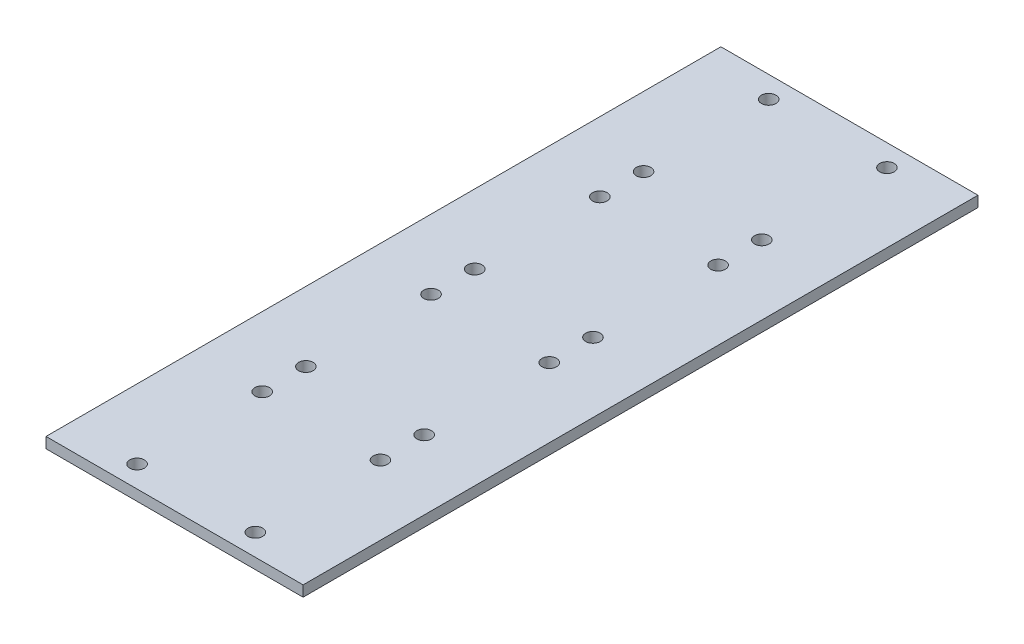
from build123d import *

# Parameters (mm, degrees)
SKETCH1_W           = 76.2
SKETCH1_H           = 200.025
SKETCH1_R           = 2.159
BOSS_EXTRUDE1_DEPTH = 3.175


with BuildPart() as part:
    # Sketch1 → Boss-Extrude1 (new body)
    with BuildSketch(Plane(origin=(0, 0, 0), x_dir=(1, 0, 0), z_dir=(0, 1, 0))):
        with Locations((17.526, 56.515)):
            Rectangle(SKETCH1_W, SKETCH1_H)
        with Locations(Location((0, 0, 0), (0, 0, 270))):
            Circle(SKETCH1_R, mode=Mode.SUBTRACT)
        with Locations(Location((35.052, 0, 0), (0, 0, 270))):
            Circle(SKETCH1_R, mode=Mode.SUBTRACT)
        with Locations(Location((0, -37.084, 0), (0, 0, 270))):
            Circle(SKETCH1_R, mode=Mode.SUBTRACT)
        with Locations(Location((35.052, -37.084, 0), (0, 0, 270))):
            Circle(SKETCH1_R, mode=Mode.SUBTRACT)
        with Locations(Location((0, 50.038, 0), (0, 0, 270))):
            Circle(SKETCH1_R, mode=Mode.SUBTRACT)
        with Locations(Location((35.052, 50.038, 0), (0, 0, 270))):
            Circle(SKETCH1_R, mode=Mode.SUBTRACT)
        with Locations(Location((0, 12.954, 0), (0, 0, 270))):
            Circle(SKETCH1_R, mode=Mode.SUBTRACT)
        with Locations(Location((35.052, 12.954, 0), (0, 0, 270))):
            Circle(SKETCH1_R, mode=Mode.SUBTRACT)
        with Locations(Location((0, 100.076, 0), (0, 0, 270))):
            Circle(SKETCH1_R, mode=Mode.SUBTRACT)
        with Locations(Location((35.052, 100.076, 0), (0, 0, 270))):
            Circle(SKETCH1_R, mode=Mode.SUBTRACT)
        with Locations(Location((0, 62.992, 0), (0, 0, 270))):
            Circle(SKETCH1_R, mode=Mode.SUBTRACT)
        with Locations(Location((35.052, 62.992, 0), (0, 0, 270))):
            Circle(SKETCH1_R, mode=Mode.SUBTRACT)
        with Locations(Location((0, 150.114, 0), (0, 0, 270))):
            Circle(SKETCH1_R, mode=Mode.SUBTRACT)
        with Locations(Location((35.052, 150.114, 0), (0, 0, 270))):
            Circle(SKETCH1_R, mode=Mode.SUBTRACT)
        with Locations(Location((0, 113.03, 0), (0, 0, 270))):
            Circle(SKETCH1_R, mode=Mode.SUBTRACT)
        with Locations(Location((35.052, 113.03, 0), (0, 0, 270))):
            Circle(SKETCH1_R, mode=Mode.SUBTRACT)
    extrude(amount=BOSS_EXTRUDE1_DEPTH)


solid = part.part
